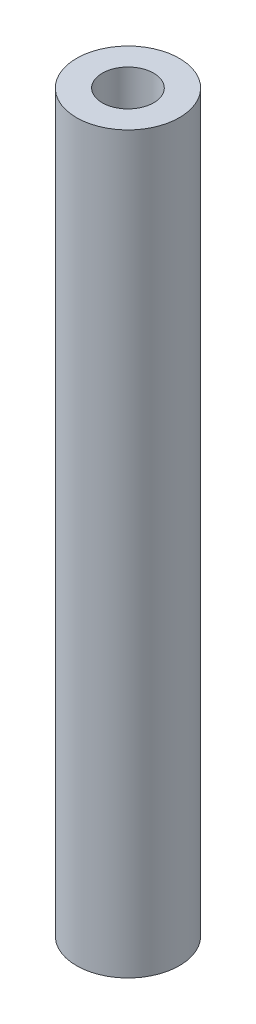
from build123d import *

# Parameters (mm, degrees)
SKETCH1_R           = 3.5
SKETCH1_R_2         = 1.75
BOSS_EXTRUDE1_DEPTH = 50


with BuildPart() as part:
    # Sketch1 → Boss-Extrude1 (new body)
    with BuildSketch(Plane(origin=(0, 0, 0), x_dir=(1, 0, 0), z_dir=(0, 1, 0))):
        with Locations(Location((0, 0, 0), (0, 0, 270))):
            Circle(SKETCH1_R)
        with Locations(Location((0, 0, 0), (0, 0, 270))):
            Circle(SKETCH1_R_2, mode=Mode.SUBTRACT)
    extrude(amount=BOSS_EXTRUDE1_DEPTH)


solid = part.part
